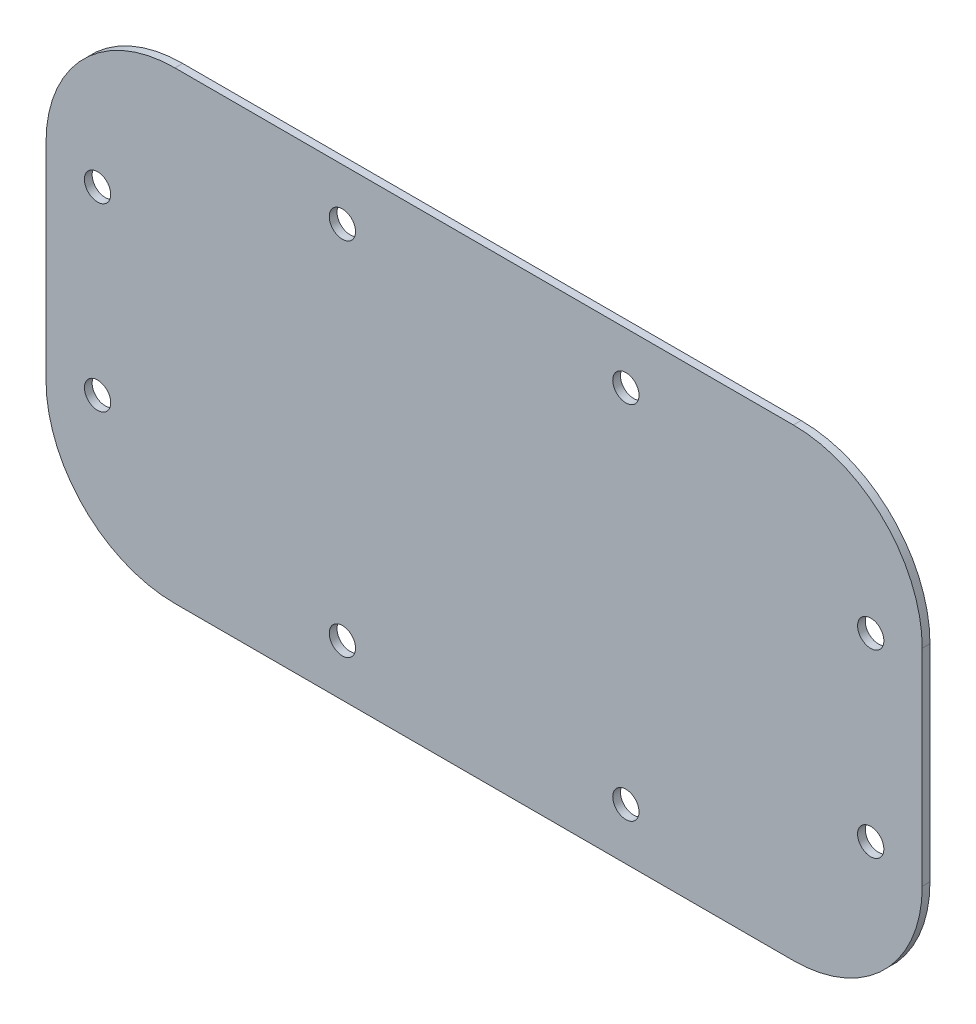
from build123d import *

# Parameters (mm, degrees)
DODANIE_WYCI_GNI_CIE1_DEPTH = 3
OTW_R_GWINTOWANY_M121_D     = 10.2


with BuildPart() as part:
    # Szkic1 → Dodanie-wyciągnięcie1 (new body)
    with BuildSketch(Plane.XY):
        with BuildLine():
            Line((-120, -90), (120, -90))
            ThreePointArc((120, -90), (155.355339059, -75.355339059), (170, -40))
            Line((170, -40), (170, 40))
            ThreePointArc((170, 40), (155.355339059, 75.355339059), (120, 90))
            Line((120, 90), (-120, 90))
            ThreePointArc((-120, 90), (-155.355339059, 75.355339059), (-170, 40))
            Line((-170, 40), (-170, -40))
            ThreePointArc((-170, -40), (-155.355339059, -75.355339059), (-120, -90))
        make_face()
    extrude(amount=DODANIE_WYCI_GNI_CIE1_DEPTH)

    # Otwór gwintowany M121 (through all)
    with Locations(Plane(origin=(0, 0, 0), x_dir=(-1, 0, 0), z_dir=(0, 0, -1))):
        with Locations((55, 70), (-55, 70), (55, -70), (-55, -70), (-150, 35), (-150, -35), (150, -35), (150, 35)):
            Hole(OTW_R_GWINTOWANY_M121_D / 2)


solid = part.part
